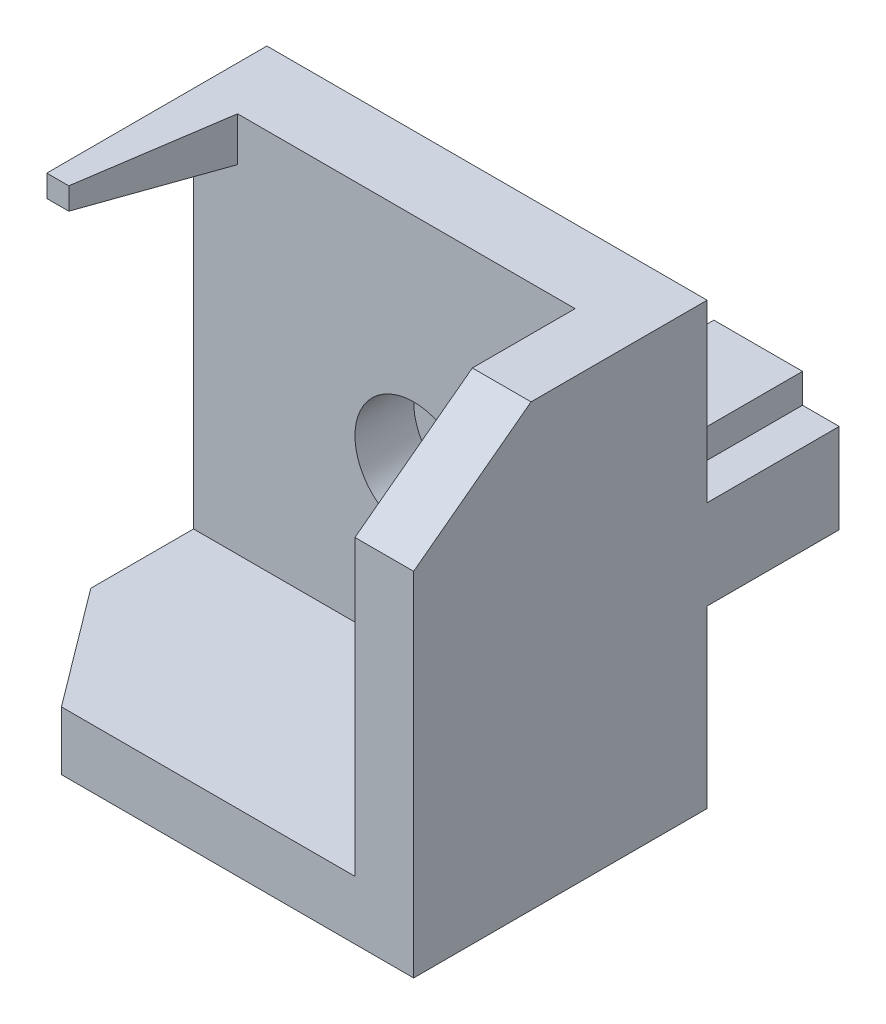
from build123d import *

# Parameters (mm, degrees)
SKETCH_1_W                   = 30
SKETCH_1_H                   = 30
EXTRUDE_1_DEPTH              = 5
SKETCH_2_W                   = 3
SKETCH_2_H                   = 3
EXTRUDE_2_DEPTH              = 10
EXTRUDE_3_DEPTH              = 7
CUT_EXTRUDE_1_DEPTH          = 10
CUT_EXTRUDE_2_DEPTH          = 10
HOLE_WIZARD_M4_1_D           = 4.5
HOLE_WIZARD_M4_1_CBORE_D     = 8
HOLE_WIZARD_M4_1_CBORE_DEPTH = 4
EXTRUDE_4_DEPTH              = 10
CHAMFER_1_SIZE               = 1
CUT_EXTRUDE_4_DEPTH          = 10
EXTRUDE_5_DEPTH              = 4
EXTRUDE_6_DEPTH              = 4


with BuildPart() as part:
    # 스케치1 → 보스-돌출1 (new body)
    with BuildSketch(Plane.XY):
        Rectangle(SKETCH_1_W, SKETCH_1_H)
    extrude(amount=EXTRUDE_1_DEPTH)

    # 스케치2 → 보스-돌출2 (add)
    with BuildSketch(Plane.XY.offset(5)):
        with Locations((-13.5, 13.5)):
            Rectangle(SKETCH_2_W, SKETCH_2_H)
    extrude(amount=EXTRUDE_2_DEPTH)

    # 스케치2<3> → 보스-돌출3 (add)
    with BuildSketch(Plane.XY.offset(5)):
        Polygon((15, 15), (11, 15), (11, -11), (-15, -11), (-15, -15), (15, -15), align=None)
    extrude(amount=EXTRUDE_3_DEPTH)

    # 스케치3 → 컷-돌출1 (cut)
    with BuildSketch(Plane(origin=(-12, 0, 0), x_dir=(0, 0, -1), z_dir=(1, 0, 0))):
        Polygon((-15, 13.5), (-5, 12), (-15, 12), align=None)
    extrude(amount=-CUT_EXTRUDE_1_DEPTH, mode=Mode.SUBTRACT)

    # 스케치4 → 컷-돌출2 (cut)
    with BuildSketch(Plane(origin=(0, 15, 0), x_dir=(1, 0, 0), z_dir=(0, 1, 0))):
        Polygon((-12, -15), (-12, -5), (-13.5, -15), align=None)
    extrude(amount=-CUT_EXTRUDE_2_DEPTH, mode=Mode.SUBTRACT)

    # M4 소켓 머리 캡 나사용 카운터보어1 (through all)
    with Locations(Plane.XY.offset(5)):
        with Locations((0, 0)):
            CounterBoreHole(HOLE_WIZARD_M4_1_D / 2, HOLE_WIZARD_M4_1_CBORE_D / 2, HOLE_WIZARD_M4_1_CBORE_DEPTH)

    # 스케치8 → 보스-돌출4 (add)
    with BuildSketch(Plane(origin=(0, 0, 0), x_dir=(-1, 0, 0), z_dir=(0, 0, -1))):
        with BuildLine():
            Line((-3.05, 15), (3.05, 15))
            Line((3.05, 15), (3.05, 12.5))
            Line((3.05, 12.5), (5.05, 12.5))
            Line((5.05, 12.5), (5.05, 6.454957169))
            ThreePointArc((5.05, 6.454957169), (0, 4.5), (-5.05, 6.454957169))
            Line((-5.05, 6.454957169), (-5.05, 12.5))
            Line((-5.05, 12.5), (-3.05, 12.5))
            Line((-3.05, 12.5), (-3.05, 15))
        make_face()
        with BuildLine():
            Line((15, 3.05), (15, -3.05))
            Line((15, -3.05), (12.5, -3.05))
            Line((12.5, -3.05), (12.5, -5.05))
            Line((12.5, -5.05), (6.454957169, -5.05))
            ThreePointArc((6.454957169, -5.05), (4.5, 0), (6.454957169, 5.05))
            Line((6.454957169, 5.05), (12.5, 5.05))
            Line((12.5, 5.05), (12.5, 3.05))
            Line((12.5, 3.05), (15, 3.05))
        make_face()
        with BuildLine():
            Line((3.05, -15), (-3.05, -15))
            Line((-3.05, -15), (-3.05, -12.5))
            Line((-3.05, -12.5), (-5.05, -12.5))
            Line((-5.05, -12.5), (-5.05, -6.454957169))
            ThreePointArc((-5.05, -6.454957169), (0, -4.5), (5.05, -6.454957169))
            Line((5.05, -6.454957169), (5.05, -12.5))
            Line((5.05, -12.5), (3.05, -12.5))
            Line((3.05, -12.5), (3.05, -15))
        make_face()
        with BuildLine():
            Line((-15, -3.05), (-15, 3.05))
            Line((-15, 3.05), (-12.5, 3.05))
            Line((-12.5, 3.05), (-12.5, 5.05))
            Line((-12.5, 5.05), (-6.454957169, 5.05))
            ThreePointArc((-6.454957169, 5.05), (-4.5, 0), (-6.454957169, -5.05))
            Line((-6.454957169, -5.05), (-12.5, -5.05))
            Line((-12.5, -5.05), (-12.5, -3.05))
            Line((-12.5, -3.05), (-15, -3.05))
        make_face()
    extrude(amount=EXTRUDE_4_DEPTH)

    # 모따기1
    chamfer_1_edges = [part.edges().sort_by_distance(p)[0] for p in [
        (-13.75, -3.05, -10),
        (-15, 0, -10),
        (-13.75, 3.05, -10),
        (-12.5, 4.05, -10),
        (-9.477478584, 5.05, -10),
        (-4.5, 0, -10),
        (-9.477478584, -5.05, -10),
        (-12.5, -4.05, -10),
        (3.05, -13.75, -10),
        (0, -15, -10),
        (-3.05, -13.75, -10),
        (-4.05, -12.5, -10),
        (-5.05, -9.477478584, -10),
        (0, -4.5, -10),
        (5.05, -9.477478584, -10),
        (4.05, -12.5, -10),
        (13.75, 3.05, -10),
        (15, 0, -10),
        (13.75, -3.05, -10),
        (12.5, -4.05, -10),
        (9.477478584, -5.05, -10),
        (4.5, 0, -10),
        (9.477478584, 5.05, -10),
        (12.5, 4.05, -10),
        (-3.05, 13.75, -10),
        (0, 15, -10),
        (3.05, 13.75, -10),
        (4.05, 12.5, -10),
        (5.05, 9.477478584, -10),
        (0, 4.5, -10),
        (-5.05, 9.477478584, -10),
        (-4.05, 12.5, -10),
    ]]
    chamfer(chamfer_1_edges, length=CHAMFER_1_SIZE)

    # 스케치9 → 컷-돌출4 (cut)
    with BuildSketch(Plane(origin=(0, 0, -10), x_dir=(-1, 0, 0), z_dir=(0, 0, -1))):
        Polygon((-6.459146565, 15), (-6.459146565, 5.734562816), (1.656191427, 2.380775176), (5.83807478, -6.065801101), (15, -6.065801101), (15, 15), align=None)
    extrude(amount=-CUT_EXTRUDE_4_DEPTH, mode=Mode.SUBTRACT)

    # 스케치11 → 보스-돌출5 (add)
    with BuildSketch(Plane.XZ.offset(15)):
        Polygon((-15, 12), (-9, 20), (15, 20), (15, 12), align=None)
    extrude(amount=-EXTRUDE_5_DEPTH)

    # 스케치12 → 보스-돌출6 (add)
    with BuildSketch(Plane(origin=(15, 0, 0), x_dir=(0, 0, -1), z_dir=(1, 0, 0))):
        Polygon((-12, -11), (-12, 15), (-20, 9), (-20, -11), align=None)
    extrude(amount=-EXTRUDE_6_DEPTH)


solid = part.part
